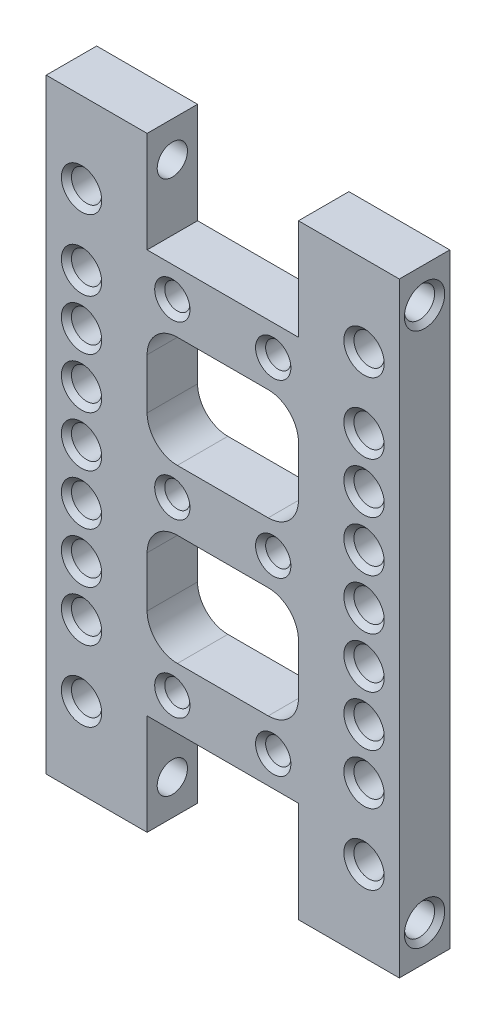
from build123d import *

# Parameters (mm, degrees)
SKETCH_1_W          = 35
SKETCH_1_H          = 60
EXTRUDE_1_DEPTH     = 5
SKETCH_2_R          = 1.5
SKETCH_2_R_2        = 0.5
SKETCH_2_W          = 15
SKETCH_2_H          = 10
CUT_EXTRUDE_1_DEPTH = 36.089172119
SKETCH_3_R          = 1.5
CUT_EXTRUDE_2_DEPTH = 47.368092477
HOLE_WIZARD_M3_1_D  = 2.5
CHAMFER_1_SIZE      = 0.5


with BuildPart() as part:
    # 草图1 → 凸台-拉伸1 (new body)
    with BuildSketch(Plane.XY):
        Rectangle(SKETCH_1_W, SKETCH_1_H)
    extrude(amount=EXTRUDE_1_DEPTH)

    # 草图2 → 切除-拉伸1 (cut, through all)
    with BuildSketch(Plane.XY.offset(5)):
        with Locations((-14, 0)):
            Circle(SKETCH_2_R)
        with Locations((-14, -15)):
            Circle(SKETCH_2_R)
        with Locations(Location((14, -15, 0), (0, 0, 180))):
            Circle(SKETCH_2_R)
        with Locations(Location((14, 0, 0), (0, 0, 180))):
            Circle(SKETCH_2_R)
        with Locations((-14, -10)):
            Circle(SKETCH_2_R)
        with Locations((-14, -22)):
            Circle(SKETCH_2_R)
        with Locations(Location((14, -22, 0), (0, 0, 180))):
            Circle(SKETCH_2_R)
        with Locations(Location((14, -10, 0), (0, 0, 180))):
            Circle(SKETCH_2_R)
        with Locations(Location((-14, 22, 0), (0, 0, 180))):
            Circle(SKETCH_2_R)
        with Locations((14, 22)):
            Circle(SKETCH_2_R)
        with Locations((14, 10)):
            Circle(SKETCH_2_R)
        with Locations(Location((-14, 10, 0), (0, 0, 180))):
            Circle(SKETCH_2_R)
        with Locations((14, 15)):
            Circle(SKETCH_2_R)
        with Locations(Location((-14, 15, 0), (0, 0, 180))):
            Circle(SKETCH_2_R)
        with Locations((-5, 0)):
            Circle(SKETCH_2_R_2)
        with Locations((5, 0)):
            Circle(SKETCH_2_R_2)
        with Locations((-14, -5)):
            Circle(SKETCH_2_R)
        with Locations(Location((14, -5, 0), (0, 0, 180))):
            Circle(SKETCH_2_R)
        with Locations((14, 5)):
            Circle(SKETCH_2_R)
        with Locations(Location((-14, 5, 0), (0, 0, 180))):
            Circle(SKETCH_2_R)
        with Locations((-5, 17)):
            Circle(SKETCH_2_R_2)
        with Locations((5, 17)):
            Circle(SKETCH_2_R_2)
        with Locations(Location((5, -17, 0), (0, 0, 180))):
            Circle(SKETCH_2_R_2)
        with Locations(Location((-5, -17, 0), (0, 0, 180))):
            Circle(SKETCH_2_R_2)
        with Locations((0, 25)):
            Rectangle(SKETCH_2_W, SKETCH_2_H)
        with Locations((0, -25)):
            Rectangle(SKETCH_2_W, SKETCH_2_H)
        with BuildLine():
            Line((7.5, 11), (7.5, 6))
            ThreePointArc((7.5, 6), (6.621320344, 3.878679656), (4.5, 3))
            Line((4.5, 3), (-4.5, 3))
            ThreePointArc((-4.5, 3), (-6.621320344, 3.878679656), (-7.5, 6))
            Line((-7.5, 6), (-7.5, 11))
            ThreePointArc((-7.5, 11), (-6.621320344, 13.121320344), (-4.5, 14))
            Line((-4.5, 14), (4.5, 14))
            ThreePointArc((4.5, 14), (6.621320344, 13.121320344), (7.5, 11))
        make_face()
        with BuildLine():
            Line((-4.5, -14), (4.5, -14))
            ThreePointArc((4.5, -14), (6.621320344, -13.121320344), (7.5, -11))
            Line((7.5, -11), (7.5, -6))
            ThreePointArc((7.5, -6), (6.621320344, -3.878679656), (4.5, -3))
            Line((4.5, -3), (-4.5, -3))
            ThreePointArc((-4.5, -3), (-6.621320344, -3.878679656), (-7.5, -6))
            Line((-7.5, -6), (-7.5, -11))
            ThreePointArc((-7.5, -11), (-6.621320344, -13.121320344), (-4.5, -14))
        make_face()
    extrude(amount=-CUT_EXTRUDE_1_DEPTH, mode=Mode.SUBTRACT)

    # 草图3 → 切除-拉伸2 (cut, through all)
    with BuildSketch(Plane(origin=(17.5, 0, 0), x_dir=(0, 0, -1), z_dir=(1, 0, 0))):
        with Locations((-2.5, -26.5)):
            Circle(SKETCH_3_R)
        with Locations((-2.5, 26.5)):
            Circle(SKETCH_3_R)
    extrude(amount=-CUT_EXTRUDE_2_DEPTH, mode=Mode.SUBTRACT)

    # M3 螺纹孔1 (through all)
    with Locations(Plane.XY.offset(5)):
        with Locations((-5, 17), (5, 17), (-5, 0), (5, 0), (-5, -17), (5, -17)):
            Hole(HOLE_WIZARD_M3_1_D / 2)

    # 倒角1
    chamfer_1_edges = [part.edges().sort_by_distance(p)[0] for p in [
        (-15.5, -5, 0),
        (-15.5, -5, 5),
        (15.5, -5, 0),
        (15.5, -5, 5),
        (12.5, 5, 0),
        (12.5, 5, 5),
        (-12.5, 5, 0),
        (-12.5, 5, 5),
        (-17.5, -26.5, 4),
        (17.5, -26.5, 4),
        (-17.5, 26.5, 4),
        (17.5, 26.5, 4),
        (6.25, -17, 5),
        (6.25, -17, 0),
        (-3.75, -17, 5),
        (-3.75, -17, 0),
        (6.25, 0, 5),
        (6.25, 0, 0),
        (-3.75, 0, 5),
        (-3.75, 0, 0),
        (6.25, 17, 5),
        (6.25, 17, 0),
        (-3.75, 17, 5),
        (-3.75, 17, 0),
        (-15.5, 0, 0),
        (-15.5, 0, 5),
        (-15.5, -15, 0),
        (-15.5, -15, 5),
        (15.5, -15, 0),
        (15.5, -15, 5),
        (15.5, 0, 0),
        (15.5, 0, 5),
        (-15.5, -10, 0),
        (-15.5, -10, 5),
        (-15.5, -22, 0),
        (-15.5, -22, 5),
        (15.5, -22, 0),
        (15.5, -22, 5),
        (15.5, -10, 0),
        (15.5, -10, 5),
        (-12.5, 22, 0),
        (-12.5, 22, 5),
        (12.5, 22, 0),
        (12.5, 22, 5),
        (12.5, 10, 0),
        (12.5, 10, 5),
        (-12.5, 10, 0),
        (-12.5, 10, 5),
        (12.5, 15, 0),
        (12.5, 15, 5),
        (-12.5, 15, 0),
        (-12.5, 15, 5),
    ]]
    chamfer(chamfer_1_edges, length=CHAMFER_1_SIZE)


solid = part.part
